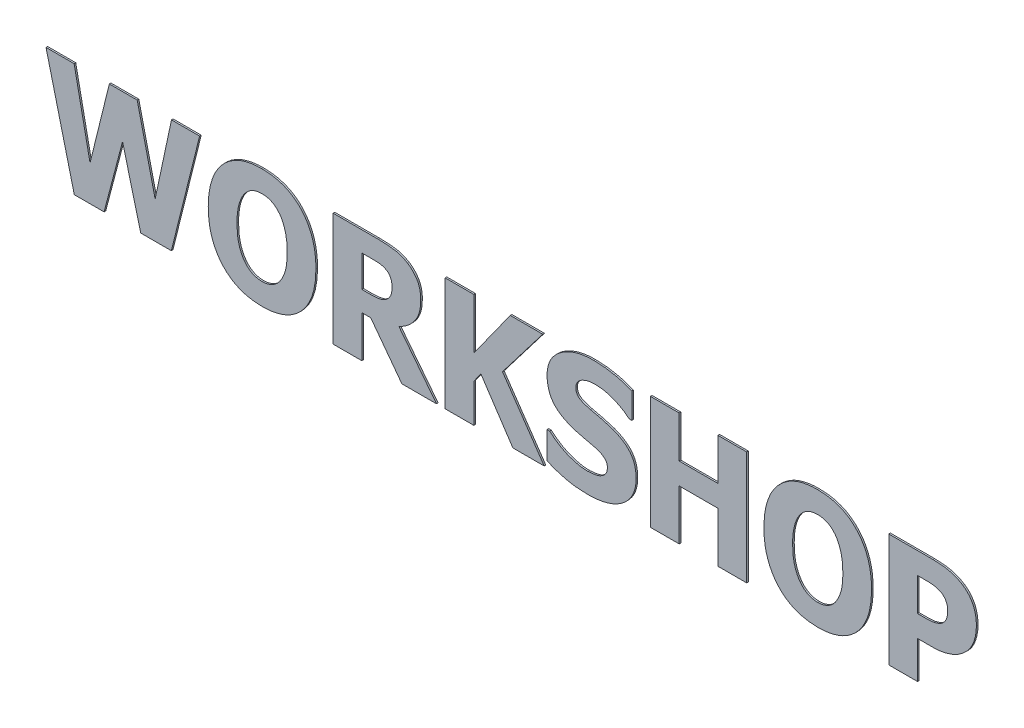
from build123d import *

# Parameters (mm, degrees)
BOSS_EXTRUDE1_DEPTH   = 2
BOSS_EXTRUDE1_2_DEPTH = 2
BOSS_EXTRUDE1_3_DEPTH = 2
BOSS_EXTRUDE1_4_DEPTH = 2
BOSS_EXTRUDE1_5_DEPTH = 2
BOSS_EXTRUDE1_6_DEPTH = 2
BOSS_EXTRUDE1_7_DEPTH = 2
BOSS_EXTRUDE1_8_DEPTH = 2


with BuildPart() as part:
    # Sketch1 → Boss-Extrude1 (new body)
    with BuildSketch(Plane.XY):
        Polygon((193.164556962, 140), (158.219936709, 0), (120.478639241, 0), (98.022151899, 86.586234177), (75.233386076, 0), (38.488924051, 0), (3.544303797, 140), (38.267405063, 140), (57.899525316, 43.556170886), (81.712816456, 140), (116.103639241, 140), (138.255537975, 45.300632911), (158.441455696, 140), align=None)
    extrude(amount=BOSS_EXTRUDE1_DEPTH)


with BuildPart() as body_2:
    # Sketch1 → Boss-Extrude1 2 (new body)
    with BuildSketch(Plane.XY):
        with BuildLine():
            add(Edge.make_bspline(
                [(336.708860759, 69.944620253), (336.658790443, 67.164216989), (336.561241052, 61.747301978), (335.714073569, 53.849942234), (334.346306395, 46.410543901), (332.418303155, 39.411771393), (329.87864808, 32.885364694), (326.846877088, 26.773474043), (323.190648714, 21.163056986), (319.034989894, 16.0200979), (314.38439322, 11.419140562), (309.28992765, 7.412439715), (303.789331489, 3.998747634), (297.868446677, 1.225043183), (291.518023102, -0.906382177), (284.778130489, -2.454279453), (277.616661888, -3.378879746), (272.71109732, -3.488262656), (270.19778481, -3.544303797)],
                knots=[0, 0, 0, 0, 1.189079844, 2.316622391, 3.39301205, 4.421840737, 5.416816174, 6.384428204, 7.335006513, 8.275362366, 9.207852477, 10.127253029, 11.042132357, 11.971180715, 12.917592702, 13.902165424, 14.925197332, 16, 16, 16, 16], degree=3))
            add(Edge.make_bspline(
                [(270.19778481, -3.544303797), (267.674728102, -3.492134328), (262.757733395, -3.39046519), (255.592789719, -2.415395693), (248.844314399, -0.887810447), (242.498406324, 1.283021893), (236.577643455, 4.082587086), (231.069958075, 7.523801264), (225.982038692, 11.57882398), (221.363335336, 16.254943386), (217.201086643, 21.418602463), (213.624300738, 27.09251463), (210.559609016, 33.167634607), (208.104540149, 39.701956061), (206.158206098, 46.648831226), (204.795418927, 54.034924349), (203.945336508, 61.848478572), (203.847576748, 67.201063638), (203.797468354, 69.944620253)],
                knots=[0, 0, 0, 0, 1.080317887, 2.105349957, 3.091355781, 4.040422853, 4.97251073, 5.890809664, 6.816459549, 7.753090285, 8.700970549, 9.651987685, 10.62100813, 11.610906846, 12.637424941, 13.707608467, 14.824996543, 16, 16, 16, 16], degree=3))
            add(Edge.make_bspline(
                [(203.797468354, 69.944620253), (203.848166743, 72.706556899), (203.947260988, 78.104993251), (204.790682778, 85.974665241), (206.158498804, 93.406264689), (208.105031387, 100.380525267), (210.554678422, 106.935452331), (213.61623598, 113.014404695), (217.211208292, 118.666904735), (221.354223001, 123.827244812), (225.983090434, 128.478044386), (231.078289555, 132.502108582), (236.576573893, 135.946994953), (242.499207831, 138.741927513), (248.840179118, 140.924183705), (255.597129139, 142.405673499), (262.757112353, 143.393166655), (267.674517496, 143.493050444), (270.19778481, 143.544303797)],
                knots=[0, 0, 0, 0, 1.181311189, 2.308971597, 3.381592327, 4.410528555, 5.402783556, 6.37049673, 7.316900563, 8.263502075, 9.196072939, 10.118016634, 11.035076724, 11.965907153, 12.913693872, 13.897490296, 14.921139532, 16, 16, 16, 16], degree=3))
            add(Edge.make_bspline(
                [(270.19778481, 143.544303797), (272.711180313, 143.488504535), (277.61690687, 143.379593733), (284.77721979, 142.451625272), (291.524159378, 140.91511485), (297.86261268, 138.739515885), (303.790386972, 135.976174685), (309.288767126, 132.558226824), (314.39315091, 128.553169146), (319.035422745, 123.922953877), (323.182966166, 118.757164536), (326.847908715, 113.144205593), (329.878349778, 107.031356168), (332.418431378, 100.505222251), (334.346094603, 93.506351056), (335.716497883, 86.058032146), (336.559787417, 78.1509912), (336.658353962, 72.724979964), (336.708860759, 69.944620253)],
                knots=[0, 0, 0, 0, 1.074060791, 2.096386557, 3.080279682, 4.027313204, 4.955720291, 5.869968128, 6.788734069, 7.723357901, 8.666132665, 9.616054842, 10.582998983, 11.577287643, 12.605406185, 13.681052873, 14.811740912, 16, 16, 16, 16], degree=3))
        make_face()
        with BuildLine():
            add(Edge.make_bspline(
                [(301.265822785, 70.055379747), (301.234078064, 72.086892796), (301.173093752, 75.989602382), (300.706765167, 81.615210054), (299.918540635, 86.762225484), (298.812100112, 91.456729694), (297.413411974, 95.703462917), (295.843098804, 99.57138613), (294.072545361, 103.065274153), (292.631457572, 105.134367011), (291.934335443, 106.13528481)],
                knots=[0, 0, 0, 0, 1.287174704, 2.472772232, 3.57375833, 4.583793058, 5.525202796, 6.403859325, 7.227871477, 8, 8, 8, 8], degree=3))
            add(Edge.make_bspline(
                [(291.934335443, 106.13528481), (291.185333192, 107.04538827), (289.730874706, 108.812682959), (287.315908656, 111.15755358), (284.687029916, 113.006500824), (281.953640386, 114.493687636), (279.119228678, 115.597834925), (276.228995295, 116.367315405), (273.288335222, 116.863891095), (271.30734599, 116.929131523), (270.308544304, 116.962025316)],
                knots=[0, 0, 0, 0, 1.126585517, 2.187672819, 3.206336016, 4.189521334, 5.156373335, 6.106816172, 7.045469219, 8, 8, 8, 8], degree=3))
            add(Edge.make_bspline(
                [(270.308544304, 116.962025316), (269.263687818, 116.939701999), (267.219431715, 116.896026549), (264.234533868, 116.427818184), (261.395044927, 115.725747614), (258.689154451, 114.67660383), (256.060397753, 113.291156382), (253.566620463, 111.368400839), (251.048598698, 109.08901875), (249.54661631, 107.273103128), (248.765822785, 106.329113924)],
                knots=[0, 0, 0, 0, 1.002961705, 1.962289189, 2.895653215, 3.80792997, 4.744195718, 5.739089679, 6.824683862, 8, 8, 8, 8], degree=3))
            add(Edge.make_bspline(
                [(248.765822785, 106.329113924), (248.069224443, 105.34653577), (246.621983926, 103.305148606), (244.82398224, 99.83043703), (243.178183607, 95.938076208), (241.792502347, 91.588609853), (240.5976068, 86.806968004), (239.843833001, 81.565637252), (239.322843319, 75.899246919), (239.268602615, 71.976548941), (239.240506329, 69.944620253)],
                knots=[0, 0, 0, 0, 0.755164283, 1.568916089, 2.449019537, 3.40530965, 4.430988336, 5.538686369, 6.72505765, 8, 8, 8, 8], degree=3))
            add(Edge.make_bspline(
                [(239.240506329, 69.944620253), (239.271394048, 67.866876711), (239.330510474, 63.890254994), (239.801353114, 58.202234288), (240.55276183, 53.061627121), (241.638901071, 48.442114623), (243.00192908, 44.276015955), (244.621058508, 40.496365647), (246.419178491, 37.033710072), (247.866837134, 34.958582389), (248.571993671, 33.94778481)],
                knots=[0, 0, 0, 0, 1.318170318, 2.522864159, 3.618647017, 4.611587825, 5.530173897, 6.396057923, 7.218717585, 8, 8, 8, 8], degree=3))
            add(Edge.make_bspline(
                [(248.571993671, 33.94778481), (249.319259904, 33.026697979), (250.774400831, 31.233078671), (253.218028413, 28.882990385), (255.842302885, 26.98169056), (258.610405081, 25.507977487), (261.462376996, 24.40678244), (264.36889951, 23.628524531), (267.319946556, 23.138379123), (269.309846042, 23.071526787), (270.308544304, 23.037974684)],
                knots=[0, 0, 0, 0, 1.126399206, 2.193421182, 3.21099292, 4.195910863, 5.165042014, 6.109693258, 7.051285721, 8, 8, 8, 8], degree=3))
            add(Edge.make_bspline(
                [(270.308544304, 23.037974684), (271.316371715, 23.070891082), (273.335024335, 23.136821788), (276.341356983, 23.642973019), (279.281054189, 24.52549535), (282.183321903, 25.667770161), (284.945854509, 27.22607241), (287.546590187, 29.144518338), (289.918406495, 31.474838386), (291.30722102, 33.239325823), (292.017405063, 34.141613924)],
                knots=[0, 0, 0, 0, 0.954659109, 1.912157864, 2.877967119, 3.858822935, 4.861119912, 5.873816251, 6.912754912, 8, 8, 8, 8], degree=3))
            add(Edge.make_bspline(
                [(292.017405063, 34.141613924), (292.728746266, 35.200555032), (294.174972846, 37.353486385), (296.01153544, 40.843696463), (297.597707167, 44.587174249), (298.952733822, 48.634224614), (300.018833083, 53.143604601), (300.725157028, 58.222906973), (301.215465123, 63.926375922), (301.248446421, 67.940511925), (301.265822785, 70.055379747)],
                knots=[0, 0, 0, 0, 0.811098523, 1.649043018, 2.504094341, 3.39537459, 4.360999606, 5.44717599, 6.655031781, 8, 8, 8, 8], degree=3))
        make_face(mode=Mode.SUBTRACT)
    extrude(amount=BOSS_EXTRUDE1_2_DEPTH)


with BuildPart() as body_3:
    # Sketch1 → Boss-Extrude1 3 (new body)
    with BuildSketch(Plane.XY):
        with BuildLine():
            Line((485.569620253, 0), (442.84414557, 0))
            Line((442.84414557, 0), (404.382911392, 51.392405063))
            Line((404.382911392, 51.392405063), (393.417721519, 51.392405063))
            Line((393.417721519, 51.392405063), (393.417721519, 0))
            Line((393.417721519, 0), (357.974683544, 0))
            Line((357.974683544, 0), (357.974683544, 140))
            Line((357.974683544, 140), (413.852848101, 140))
            add(Edge.make_bspline(
                [(413.852848101, 140), (415.717633835, 139.987060547), (419.320224568, 139.962062739), (424.540344665, 139.686243322), (429.389195696, 139.211487907), (433.917463522, 138.596545647), (438.197976362, 137.704332633), (442.258376503, 136.343702791), (446.182897464, 134.655684296), (448.627361424, 133.197500233), (449.849683544, 132.46835443)],
                knots=[0, 0, 0, 0, 1.199793894, 2.317889013, 3.362092139, 4.333845176, 5.257590495, 6.170331022, 7.085098041, 8, 8, 8, 8], degree=3))
            add(Edge.make_bspline(
                [(449.849683544, 132.46835443), (451.054490233, 131.649281641), (453.43308472, 130.032223866), (456.574467779, 127.094487243), (459.366758765, 123.874569706), (461.770132403, 120.299215148), (463.769495252, 116.325204082), (465.089429754, 111.815193185), (465.936219158, 106.841069751), (466.028175088, 103.351643287), (466.075949367, 101.538765823)],
                knots=[0, 0, 0, 0, 0.953924463, 1.883289238, 2.810108911, 3.743307755, 4.701369409, 5.714009315, 6.812348952, 8, 8, 8, 8], degree=3))
            add(Edge.make_bspline(
                [(466.075949367, 101.538765823), (466.059237539, 100.227036461), (466.026570541, 97.662968549), (465.638948759, 93.920702229), (465.111129662, 90.361571462), (464.303495303, 86.989622787), (463.249879837, 83.819304221), (462.003307686, 80.817773683), (460.506922807, 78.019141497), (458.200809156, 74.550819213), (454.865551051, 70.552438315), (450.217242035, 66.304107475), (444.987793467, 62.502350438), (441.110612129, 60.499213803), (439.133702532, 59.477848101)],
                knots=[0, 0, 0, 0, 0.888936574, 1.737625011, 2.548320823, 3.326937543, 4.084834997, 4.811205944, 5.527889522, 6.232533624, 7.632244915, 9.044932759, 10.493260882, 12, 12, 12, 12], degree=3))
            Line((439.133702532, 59.477848101), (485.569620253, 0))
        make_face()
        with BuildLine():
            add(Edge.make_bspline(
                [(430.632911392, 97.496044304), (430.61918029, 98.374915222), (430.592581296, 100.07740657), (430.172350062, 102.531332311), (429.600114691, 104.817643531), (428.686252954, 106.88479496), (427.560946235, 108.796424219), (426.03527056, 110.429592353), (424.192331729, 111.854397105), (422.782870152, 112.572908961), (422.049050633, 112.946993671)],
                knots=[0, 0, 0, 0, 1.119761289, 2.169128442, 3.168954851, 4.118408773, 5.043447249, 5.985348535, 6.951095516, 8, 8, 8, 8], degree=3))
            add(Edge.make_bspline(
                [(422.049050633, 112.946993671), (420.916212447, 113.383893801), (418.582845326, 114.283800257), (415.400911739, 114.784611202), (412.645124844, 114.973307579), (410.301429451, 115.13383544), (407.714945512, 115.163974649), (405.90580812, 115.181009237), (404.964398734, 115.189873418)],
                knots=[0, 0, 0, 0, 1.256441546, 2.587959541, 3.317795867, 4.123378269, 5.023474215, 6, 6, 6, 6], degree=3))
            Line((404.964398734, 115.189873418), (393.417721519, 115.189873418))
            Line((393.417721519, 115.189873418), (393.417721519, 76.202531646))
            Line((393.417721519, 76.202531646), (403.303006329, 76.202531646))
            add(Edge.make_bspline(
                [(403.303006329, 76.202531646), (404.456846525, 76.213368735), (406.673527492, 76.234188231), (409.872267316, 76.386098453), (412.788113631, 76.706954612), (415.473539711, 77.060878928), (417.92469215, 77.660178239), (420.168553149, 78.537964007), (422.252583019, 79.627335879), (423.465719269, 80.594074852), (424.070411392, 81.075949367)],
                knots=[0, 0, 0, 0, 1.270824428, 2.441423287, 3.524730841, 4.500863784, 5.422940595, 6.295084937, 7.15017896, 8, 8, 8, 8], degree=3))
            add(Edge.make_bspline(
                [(424.070411392, 81.075949367), (424.599514574, 81.534021567), (425.653693761, 82.446679429), (427.001465145, 84.024053977), (428.122302096, 85.743271638), (429.057277328, 87.604631816), (429.78787717, 89.685190063), (430.267376658, 92.041436412), (430.571302274, 94.67298005), (430.611740941, 96.525968031), (430.632911392, 97.496044304)],
                knots=[0, 0, 0, 0, 0.914359853, 1.821760216, 2.702345359, 3.593131941, 4.539985656, 5.57704332, 6.731533712, 8, 8, 8, 8], degree=3))
        make_face(mode=Mode.SUBTRACT)
    extrude(amount=BOSS_EXTRUDE1_3_DEPTH)


with BuildPart() as body_4:
    # Sketch1 → Boss-Extrude1 4 (new body)
    with BuildSketch(Plane.XY):
        Polygon((618.481012658, 0), (579.798259494, 0), (540.340189873, 59.339398734), (531.64556962, 47.238924051), (531.64556962, 0), (496.202531646, 0), (496.202531646, 140), (531.64556962, 140), (531.64556962, 77.310126582), (576.558544304, 140), (616.708860759, 140), (567.005537975, 75.039556962), align=None)
    extrude(amount=BOSS_EXTRUDE1_4_DEPTH)


with BuildPart() as body_5:
    # Sketch1 → Boss-Extrude1 5 (new body)
    with BuildSketch(Plane.XY):
        with BuildLine():
            add(Edge.make_bspline(
                [(672.088607595, -3.544303797), (669.530664289, -3.510003211), (664.573914765, -3.443535978), (657.371197847, -2.84912766), (650.641624835, -1.909041645), (644.352465668, -0.52448944), (638.43508191, 1.15981472), (632.76516752, 3.037058912), (627.285385348, 5.018077661), (623.76232562, 6.553233457), (622.025316456, 7.310126582)],
                knots=[0, 0, 0, 0, 1.188587951, 2.303230391, 3.356350567, 4.344124042, 5.293358606, 6.214416522, 7.119636025, 8, 8, 8, 8], degree=3))
            Line((622.025316456, 7.310126582), (622.025316456, 40.759493671))
            Line((622.025316456, 40.759493671), (625.181962025, 40.759493671))
            add(Edge.make_bspline(
                [(625.181962025, 40.759493671), (626.927777511, 39.249418597), (630.384642955, 36.259339529), (636.002582133, 32.38351496), (641.848448741, 29.012606631), (647.927865908, 26.236732244), (654.074066036, 24.014333902), (660.210182493, 22.480446613), (666.237701352, 21.430777729), (670.24760817, 21.320339478), (672.227056962, 21.265822785)],
                knots=[0, 0, 0, 0, 1.064005933, 2.106823643, 3.142324773, 4.172904671, 5.185521809, 6.151983196, 7.087745727, 8, 8, 8, 8], degree=3))
            add(Edge.make_bspline(
                [(672.227056962, 21.265822785), (672.762619884, 21.279658753), (673.908999767, 21.309274836), (675.746454146, 21.459021893), (677.814186659, 21.683089721), (680.052886905, 21.969513749), (682.29171746, 22.365535987), (684.377328444, 22.854664208), (686.223012459, 23.445308539), (687.322957963, 23.976801652), (687.84414557, 24.228639241)],
                knots=[0, 0, 0, 0, 0.803171281, 1.719199296, 2.763054104, 3.921781135, 5.102693432, 6.170135007, 7.132954358, 8, 8, 8, 8], degree=3))
            add(Edge.make_bspline(
                [(687.84414557, 24.228639241), (688.432913527, 24.539136505), (689.601943014, 25.155645018), (691.215304224, 26.29529486), (692.659273367, 27.626861307), (694.018897468, 29.06865939), (695.107950932, 30.79253638), (695.933379959, 32.749676851), (696.353378878, 34.982656055), (696.420581857, 36.539940057), (696.455696203, 37.353639241)],
                knots=[0, 0, 0, 0, 0.958250464, 1.902656275, 2.834625234, 3.785374419, 4.748042504, 5.755488648, 6.827216455, 8, 8, 8, 8], degree=3))
            add(Edge.make_bspline(
                [(696.455696203, 37.353639241), (696.413077555, 38.208980577), (696.330073335, 39.87484619), (695.524744978, 42.239746748), (694.168589302, 44.314082787), (692.347191785, 46.10469587), (690.174760355, 47.598977347), (687.848009528, 49.008384766), (685.253131039, 50.056697083), (683.44557123, 50.612002492), (682.527689873, 50.893987342)],
                knots=[0, 0, 0, 0, 0.976980105, 1.90276968, 2.820378867, 3.79191295, 4.806747273, 5.83454199, 6.900377446, 8, 8, 8, 8], degree=3))
            add(Edge.make_bspline(
                [(682.527689873, 50.893987342), (680.076213081, 51.528331495), (675.031713573, 52.833646227), (667.321631263, 54.503759796), (659.617231601, 56.282041763), (654.65233978, 57.909926061), (652.234968354, 58.702531646)],
                knots=[0, 0, 0, 0, 0.970778871, 1.997609583, 3.025049981, 4, 4, 4, 4], degree=3))
            add(Edge.make_bspline(
                [(652.234968354, 58.702531646), (650.927463692, 59.195271424), (648.38662316, 60.152800093), (644.764182995, 61.803473174), (641.424953328, 63.552380015), (638.375302975, 65.456532439), (635.609365103, 67.464115634), (633.119334221, 69.606586943), (630.932284442, 71.885028367), (628.984749842, 74.276004392), (627.367460625, 76.858107155), (625.905216072, 79.534412097), (624.719797376, 82.400452024), (623.713226837, 85.402270258), (622.985275574, 88.578368143), (622.421570585, 91.886290602), (622.086249128, 95.357018822), (622.04591477, 97.726069515), (622.025316456, 98.935917722)],
                knots=[0, 0, 0, 0, 1.232734205, 2.395541005, 3.510463934, 4.556875624, 5.565319495, 6.523880384, 7.451310254, 8.349375782, 9.239576409, 10.136015274, 11.0376197, 11.972601359, 12.926826808, 13.909683999, 14.932498543, 16, 16, 16, 16], degree=3))
            add(Edge.make_bspline(
                [(622.025316456, 98.935917722), (622.069373647, 100.554344067), (622.156004572, 103.736702478), (622.95458943, 108.395691259), (624.257704342, 112.818819076), (626.064282094, 117.013236705), (628.421838352, 120.950394488), (631.291798777, 124.643432631), (634.67823051, 128.101876946), (638.545697898, 131.278722914), (642.778811307, 134.182531459), (647.345239342, 136.656507114), (652.129742564, 138.814595381), (657.179587114, 140.560062917), (662.503453259, 141.877480686), (668.063680925, 142.842557889), (673.884690474, 143.439227315), (677.846659695, 143.508788832), (679.869462025, 143.544303797)],
                knots=[0, 0, 0, 0, 0.951733787, 1.8714216, 2.771937187, 3.659834458, 4.551246461, 5.464900409, 6.405895824, 7.393377429, 8.405714223, 9.421759516, 10.445282372, 11.49132611, 12.560961497, 13.669079994, 14.809937645, 16, 16, 16, 16], degree=3))
            add(Edge.make_bspline(
                [(679.869462025, 143.544303797), (681.93786691, 143.51035324), (686.0798811, 143.442366699), (692.271208014, 142.954128455), (698.447345606, 142.189037409), (704.54021813, 141.072461567), (710.484027313, 139.735698603), (716.158883544, 138.159141603), (721.521983043, 136.382168305), (724.919608759, 134.962787546), (726.582278481, 134.268196203)],
                knots=[0, 0, 0, 0, 1.035526462, 2.073658467, 3.107699001, 4.15013179, 5.173679131, 6.156969703, 7.09809057, 8, 8, 8, 8], degree=3))
            Line((726.582278481, 134.268196203), (726.582278481, 102.784810127))
            Line((726.582278481, 102.784810127), (723.481012658, 102.784810127))
            add(Edge.make_bspline(
                [(723.481012658, 102.784810127), (722.13411137, 103.88139387), (719.384609511, 106.119909094), (714.807060328, 109.052395374), (709.838809261, 111.783833147), (704.497109344, 114.179752954), (698.91691474, 116.23061095), (693.167711924, 117.643761393), (687.349490952, 118.591889793), (683.435943824, 118.686688395), (681.475474684, 118.734177215)],
                knots=[0, 0, 0, 0, 0.909132475, 1.855860894, 2.842486714, 3.876811078, 4.919788485, 5.951669293, 6.973900401, 8, 8, 8, 8], degree=3))
            add(Edge.make_bspline(
                [(681.475474684, 118.734177215), (680.024528516, 118.709270216), (677.258419852, 118.661787085), (673.22664419, 118.104248359), (669.314377539, 117.015956355), (666.831464064, 115.873547995), (665.526107595, 115.272943038)],
                knots=[0, 0, 0, 0, 1.055808145, 2.01281076, 2.955263502, 4, 4, 4, 4], degree=3))
            add(Edge.make_bspline(
                [(665.526107595, 115.272943038), (664.991663591, 114.98162979), (663.918419713, 114.396629009), (662.436463099, 113.260298991), (661.063729249, 111.939691321), (659.816031879, 110.445539147), (658.750920282, 108.818840907), (658.043069465, 107.02446453), (657.529187832, 105.167148318), (657.488734382, 103.87753795), (657.46835443, 103.227848101)],
                knots=[0, 0, 0, 0, 0.957416142, 1.922635494, 2.930164298, 3.951958416, 4.984347753, 5.975062963, 6.979861616, 8, 8, 8, 8], degree=3))
            add(Edge.make_bspline(
                [(657.46835443, 103.227848101), (657.51710634, 102.364906821), (657.611087576, 100.701376358), (658.311832889, 98.330032984), (659.542522598, 96.263579292), (660.945493308, 94.781443795), (662.35510944, 93.7637183), (663.629716045, 92.989548706), (665.138714119, 92.238072217), (666.874497965, 91.548858521), (668.801480724, 90.803582064), (670.959636463, 90.125903725), (673.345585214, 89.465338676), (675.013541468, 89.046974633), (675.882120253, 88.829113924)],
                knots=[0, 0, 0, 0, 1.214264784, 2.34079248, 3.441844924, 4.572488008, 5.185916398, 5.885766898, 6.670379076, 7.556104553, 8.514370256, 9.57884454, 10.739196989, 12, 12, 12, 12], degree=3))
            add(Edge.make_bspline(
                [(675.882120253, 88.829113924), (678.181266599, 88.306521762), (682.691912955, 87.281259305), (689.451244457, 85.680411257), (696.341907825, 83.913241735), (700.915272692, 82.32024062), (703.295094937, 81.491297468)],
                knots=[0, 0, 0, 0, 0.996266869, 1.954554799, 2.935620461, 4, 4, 4, 4], degree=3))
            add(Edge.make_bspline(
                [(703.295094937, 81.491297468), (704.474297289, 81.046352578), (706.778274512, 80.176999755), (710.03911098, 78.624283692), (713.10591321, 77.044038694), (715.906541499, 75.283389602), (718.490501985, 73.429009171), (720.853152853, 71.469648174), (722.965240215, 69.377502881), (724.875799894, 67.180033671), (726.539477868, 64.811716098), (727.993121456, 62.288243079), (729.178302571, 59.568159235), (730.183546377, 56.683405135), (730.950183467, 53.605229124), (731.501909964, 50.347199632), (731.838234419, 46.913730771), (731.878280206, 44.563007891), (731.898734177, 43.362341772)],
                knots=[0, 0, 0, 0, 1.17454689, 2.294881178, 3.365011102, 4.38938974, 5.375760562, 6.328835541, 7.247690706, 8.144686596, 9.040029798, 9.941965584, 10.855040075, 11.802113214, 12.787244475, 13.808691087, 14.880756899, 16, 16, 16, 16], degree=3))
            add(Edge.make_bspline(
                [(731.898734177, 43.362341772), (731.852366523, 41.64287478), (731.761416556, 38.270147264), (731.001450938, 33.335006508), (729.728751698, 28.661686462), (727.942485639, 24.246631731), (725.652469956, 20.094914664), (722.871680355, 16.186655056), (719.536993745, 12.578509423), (715.750161954, 9.240882374), (711.547396103, 6.219880836), (706.944544112, 3.612934907), (701.998857437, 1.402227723), (696.704504713, -0.440671924), (691.04823716, -1.839138648), (685.038047321, -2.819316732), (678.682971469, -3.44842657), (674.323803084, -3.51180569), (672.088607595, -3.544303797)],
                knots=[0, 0, 0, 0, 0.965575501, 1.893972421, 2.797150248, 3.681070906, 4.56293602, 5.455031491, 6.368877871, 7.316649527, 8.286503653, 9.271159268, 10.283057314, 11.32599161, 12.416327018, 13.55177918, 14.744656859, 16, 16, 16, 16], degree=3))
        make_face()
    extrude(amount=BOSS_EXTRUDE1_5_DEPTH)


with BuildPart() as body_6:
    # Sketch1 → Boss-Extrude1 6 (new body)
    with BuildSketch(Plane.XY):
        Polygon((868.35443038, 0), (832.911392405, 0), (832.911392405, 62.025316456), (785.063291139, 62.025316456), (785.063291139, 0), (749.620253165, 0), (749.620253165, 140), (785.063291139, 140), (785.063291139, 88.607594937), (832.911392405, 88.607594937), (832.911392405, 140), (868.35443038, 140), align=None)
    extrude(amount=BOSS_EXTRUDE1_6_DEPTH)


with BuildPart() as body_7:
    # Sketch1 → Boss-Extrude1 7 (new body)
    with BuildSketch(Plane.XY):
        with BuildLine():
            add(Edge.make_bspline(
                [(1022.53164557, 69.944620253), (1022.481575253, 67.164216989), (1022.384025862, 61.747301978), (1021.536858379, 53.849942234), (1020.169091205, 46.410543901), (1018.241087965, 39.411771393), (1015.70143289, 32.885364694), (1012.669661899, 26.773474043), (1009.013433524, 21.163056986), (1004.857774704, 16.0200979), (1000.20717803, 11.419140562), (995.11271246, 7.412439715), (989.612116299, 3.998747634), (983.691231487, 1.225043183), (977.340807912, -0.906382177), (970.600915299, -2.454279453), (963.439446698, -3.378879746), (958.53388213, -3.488262656), (956.02056962, -3.544303797)],
                knots=[0, 0, 0, 0, 1.189079844, 2.316622391, 3.39301205, 4.421840737, 5.416816174, 6.384428204, 7.335006513, 8.275362366, 9.207852477, 10.127253029, 11.042132357, 11.971180715, 12.917592702, 13.902165424, 14.925197332, 16, 16, 16, 16], degree=3))
            add(Edge.make_bspline(
                [(956.02056962, -3.544303797), (953.497512913, -3.492134328), (948.580518205, -3.39046519), (941.415574529, -2.415395693), (934.667099209, -0.887810447), (928.321191134, 1.283021893), (922.400428266, 4.082587086), (916.892742885, 7.523801264), (911.804823502, 11.57882398), (907.186120146, 16.254943386), (903.023871453, 21.418602463), (899.447085548, 27.09251463), (896.382393826, 33.167634607), (893.92732496, 39.701956061), (891.980990908, 46.648831226), (890.618203737, 54.034924349), (889.768121318, 61.848478572), (889.670361558, 67.201063638), (889.620253165, 69.944620253)],
                knots=[0, 0, 0, 0, 1.080317887, 2.105349957, 3.091355781, 4.040422853, 4.97251073, 5.890809664, 6.816459549, 7.753090285, 8.700970549, 9.651987685, 10.62100813, 11.610906846, 12.637424941, 13.707608467, 14.824996543, 16, 16, 16, 16], degree=3))
            add(Edge.make_bspline(
                [(889.620253165, 69.944620253), (889.670951553, 72.706556899), (889.770045798, 78.104993251), (890.613467588, 85.974665241), (891.981283614, 93.406264689), (893.927816197, 100.380525267), (896.377463232, 106.935452331), (899.43902079, 113.014404695), (903.033993102, 118.666904735), (907.177007811, 123.827244812), (911.805875244, 128.478044386), (916.901074365, 132.502108582), (922.399358703, 135.946994953), (928.321992641, 138.741927513), (934.662963928, 140.924183705), (941.419913949, 142.405673499), (948.579897163, 143.393166655), (953.497302306, 143.493050444), (956.02056962, 143.544303797)],
                knots=[0, 0, 0, 0, 1.181311189, 2.308971597, 3.381592327, 4.410528555, 5.402783556, 6.37049673, 7.316900563, 8.263502075, 9.196072939, 10.118016634, 11.035076724, 11.965907153, 12.913693872, 13.897490296, 14.921139532, 16, 16, 16, 16], degree=3))
            add(Edge.make_bspline(
                [(956.02056962, 143.544303797), (958.533965123, 143.488504535), (963.439691681, 143.379593733), (970.6000046, 142.451625272), (977.346944188, 140.91511485), (983.68539749, 138.739515885), (989.613171783, 135.976174685), (995.111551936, 132.558226824), (1000.21593572, 128.553169146), (1004.858207555, 123.922953877), (1009.005750976, 118.757164536), (1012.670693525, 113.144205593), (1015.701134588, 107.031356168), (1018.241216188, 100.505222251), (1020.168879413, 93.506351056), (1021.539282693, 86.058032146), (1022.382572227, 78.1509912), (1022.481138772, 72.724979964), (1022.53164557, 69.944620253)],
                knots=[0, 0, 0, 0, 1.074060791, 2.096386557, 3.080279682, 4.027313204, 4.955720291, 5.869968128, 6.788734069, 7.723357901, 8.666132665, 9.616054842, 10.582998983, 11.577287643, 12.605406185, 13.681052873, 14.811740912, 16, 16, 16, 16], degree=3))
        make_face()
        with BuildLine():
            add(Edge.make_bspline(
                [(987.088607595, 70.055379747), (987.056862874, 72.086892796), (986.995878562, 75.989602382), (986.529549977, 81.615210054), (985.741325445, 86.762225484), (984.634884922, 91.456729694), (983.236196784, 95.703462917), (981.665883614, 99.57138613), (979.895330171, 103.065274153), (978.454242382, 105.134367011), (977.757120253, 106.13528481)],
                knots=[0, 0, 0, 0, 1.287174704, 2.472772232, 3.57375833, 4.583793058, 5.525202796, 6.403859325, 7.227871477, 8, 8, 8, 8], degree=3))
            add(Edge.make_bspline(
                [(977.757120253, 106.13528481), (977.008118002, 107.04538827), (975.553659516, 108.812682959), (973.138693467, 111.15755358), (970.509814726, 113.006500824), (967.776425196, 114.493687636), (964.942013488, 115.597834925), (962.051780105, 116.367315405), (959.111120032, 116.863891095), (957.1301308, 116.929131523), (956.131329114, 116.962025316)],
                knots=[0, 0, 0, 0, 1.126585517, 2.187672819, 3.206336016, 4.189521334, 5.156373335, 6.106816172, 7.045469219, 8, 8, 8, 8], degree=3))
            add(Edge.make_bspline(
                [(956.131329114, 116.962025316), (955.086472628, 116.939701999), (953.042216526, 116.896026549), (950.057318678, 116.427818184), (947.217829737, 115.725747614), (944.511939262, 114.67660383), (941.883182564, 113.291156382), (939.389405274, 111.368400839), (936.871383508, 109.08901875), (935.36940112, 107.273103128), (934.588607595, 106.329113924)],
                knots=[0, 0, 0, 0, 1.002961705, 1.962289189, 2.895653215, 3.80792997, 4.744195718, 5.739089679, 6.824683862, 8, 8, 8, 8], degree=3))
            add(Edge.make_bspline(
                [(934.588607595, 106.329113924), (933.892009253, 105.34653577), (932.444768736, 103.305148606), (930.64676705, 99.83043703), (929.000968417, 95.938076208), (927.615287157, 91.588609853), (926.42039161, 86.806968004), (925.666617811, 81.565637252), (925.145628129, 75.899246919), (925.091387425, 71.976548941), (925.063291139, 69.944620253)],
                knots=[0, 0, 0, 0, 0.755164283, 1.568916089, 2.449019537, 3.40530965, 4.430988336, 5.538686369, 6.72505765, 8, 8, 8, 8], degree=3))
            add(Edge.make_bspline(
                [(925.063291139, 69.944620253), (925.094178858, 67.866876711), (925.153295284, 63.890254994), (925.624137925, 58.202234288), (926.37554664, 53.061627121), (927.461685881, 48.442114623), (928.82471389, 44.276015955), (930.443843318, 40.496365647), (932.241963301, 37.033710072), (933.689621944, 34.958582389), (934.394778481, 33.94778481)],
                knots=[0, 0, 0, 0, 1.318170318, 2.522864159, 3.618647017, 4.611587825, 5.530173897, 6.396057923, 7.218717585, 8, 8, 8, 8], degree=3))
            add(Edge.make_bspline(
                [(934.394778481, 33.94778481), (935.142044714, 33.026697979), (936.597185641, 31.233078671), (939.040813223, 28.882990385), (941.665087695, 26.98169056), (944.433189892, 25.507977487), (947.285161806, 24.40678244), (950.19168432, 23.628524531), (953.142731366, 23.138379123), (955.132630852, 23.071526787), (956.131329114, 23.037974684)],
                knots=[0, 0, 0, 0, 1.126399206, 2.193421182, 3.21099292, 4.195910863, 5.165042014, 6.109693258, 7.051285721, 8, 8, 8, 8], degree=3))
            add(Edge.make_bspline(
                [(956.131329114, 23.037974684), (957.139156526, 23.070891082), (959.157809146, 23.136821788), (962.164141793, 23.642973019), (965.103838999, 24.52549535), (968.006106713, 25.667770161), (970.768639319, 27.22607241), (973.369374997, 29.144518338), (975.741191305, 31.474838386), (977.13000583, 33.239325823), (977.840189873, 34.141613924)],
                knots=[0, 0, 0, 0, 0.954659109, 1.912157864, 2.877967119, 3.858822935, 4.861119912, 5.873816251, 6.912754912, 8, 8, 8, 8], degree=3))
            add(Edge.make_bspline(
                [(977.840189873, 34.141613924), (978.551531076, 35.200555032), (979.997757656, 37.353486385), (981.83432025, 40.843696463), (983.420491977, 44.587174249), (984.775518632, 48.634224614), (985.841617893, 53.143604601), (986.547941838, 58.222906973), (987.038249934, 63.926375922), (987.071231232, 67.940511925), (987.088607595, 70.055379747)],
                knots=[0, 0, 0, 0, 0.811098523, 1.649043018, 2.504094341, 3.39537459, 4.360999606, 5.44717599, 6.655031781, 8, 8, 8, 8], degree=3))
        make_face(mode=Mode.SUBTRACT)
    extrude(amount=BOSS_EXTRUDE1_7_DEPTH)


with BuildPart() as body_8:
    # Sketch1 → Boss-Extrude1 8 (new body)
    with BuildSketch(Plane.XY):
        with BuildLine():
            add(Edge.make_bspline(
                [(1151.898734177, 95.945411392), (1151.861948047, 94.337668897), (1151.788977536, 91.148483407), (1151.191557157, 86.432442606), (1150.215765218, 81.830279007), (1148.880334024, 77.386641679), (1147.173903472, 73.167159321), (1145.097060796, 69.286902329), (1142.691094439, 65.746851324), (1140.793442952, 63.683867421), (1139.853639241, 62.662183544)],
                knots=[0, 0, 0, 0, 1.063710297, 2.110020389, 3.140321323, 4.174147137, 5.176882261, 6.147031497, 7.082325343, 8, 8, 8, 8], degree=3))
            add(Edge.make_bspline(
                [(1139.853639241, 62.662183544), (1138.628527467, 61.466390724), (1136.15121544, 59.048364876), (1132.010557097, 55.824578339), (1127.499323881, 52.914550371), (1124.211755218, 51.426017731), (1122.547468354, 50.672468354)],
                knots=[0, 0, 0, 0, 0.968764832, 1.958950049, 2.966746259, 4, 4, 4, 4], degree=3))
            add(Edge.make_bspline(
                [(1122.547468354, 50.672468354), (1120.759053888, 50.000941735), (1117.081266613, 48.619979938), (1112.228730241, 47.425193627), (1108.104709776, 46.736078595), (1104.797417036, 46.342869404), (1101.302964489, 46.128737625), (1098.909822295, 46.093849549), (1097.681962025, 46.075949367)],
                knots=[0, 0, 0, 0, 1.350376915, 2.776984378, 3.525044536, 4.307277317, 5.131507131, 6, 6, 6, 6], degree=3))
            Line((1097.681962025, 46.075949367), (1079.240506329, 46.075949367))
            Line((1079.240506329, 46.075949367), (1079.240506329, 0))
            Line((1079.240506329, 0), (1043.797468354, 0))
            Line((1043.797468354, 0), (1043.797468354, 140))
            Line((1043.797468354, 140), (1098.318829114, 140))
            add(Edge.make_bspline(
                [(1098.318829114, 140), (1100.276388634, 139.975467254), (1104.057759401, 139.928077936), (1109.521876766, 139.508927967), (1114.574593399, 138.833683227), (1119.246358421, 137.855821783), (1123.615972328, 136.614196209), (1127.728177104, 135.026417794), (1131.63958801, 133.121769018), (1134.070661288, 131.577976831), (1135.284810127, 130.806962025)],
                knots=[0, 0, 0, 0, 1.214603842, 2.346221106, 3.3984458, 4.37574822, 5.305696887, 6.214088113, 7.108063561, 8, 8, 8, 8], degree=3))
            add(Edge.make_bspline(
                [(1135.284810127, 130.806962025), (1136.560699325, 129.901535536), (1139.105618354, 128.095550263), (1142.390395451, 124.739768854), (1145.292840317, 121.006500518), (1147.66031464, 116.786674315), (1149.590486339, 112.177268615), (1150.94085241, 107.131069246), (1151.745250506, 101.675522835), (1151.846492774, 97.895775633), (1151.898734177, 95.945411392)],
                knots=[0, 0, 0, 0, 0.929697031, 1.854395874, 2.783053157, 3.737870402, 4.725635949, 5.75066038, 6.839332018, 8, 8, 8, 8], degree=3))
        make_face()
        with BuildLine():
            add(Edge.make_bspline(
                [(1116.455696203, 95.059335443), (1116.430071016, 95.985471292), (1116.379863182, 97.800063973), (1115.805185115, 100.401403488), (1114.916480643, 102.821531108), (1113.642434743, 104.984630181), (1112.115914022, 106.870165634), (1110.49171212, 108.519715813), (1108.660397021, 109.788730518), (1107.33743671, 110.38208531), (1106.681170886, 110.676424051)],
                knots=[0, 0, 0, 0, 1.134580206, 2.223001021, 3.251622356, 4.286955405, 5.286292656, 6.223296996, 7.118651216, 8, 8, 8, 8], degree=3))
            add(Edge.make_bspline(
                [(1106.681170886, 110.676424051), (1105.845668476, 111.002473037), (1104.212714725, 111.639721847), (1101.742990468, 112.368899822), (1099.32020589, 112.832685812), (1096.885501608, 113.120404371), (1094.267361355, 113.229935155), (1091.323633142, 113.353964827), (1087.962877413, 113.394769595), (1085.590696053, 113.409779136), (1084.335443038, 113.417721519)],
                knots=[0, 0, 0, 0, 0.948525831, 1.853853198, 2.719395299, 3.555067585, 4.444940828, 5.490429218, 6.672046606, 8, 8, 8, 8], degree=3))
            Line((1084.335443038, 113.417721519), (1079.240506329, 113.417721519))
            Line((1079.240506329, 113.417721519), (1079.240506329, 72.658227848))
            Line((1079.240506329, 72.658227848), (1081.732594937, 72.658227848))
            add(Edge.make_bspline(
                [(1081.732594937, 72.658227848), (1083.384793996, 72.667557237), (1086.578516648, 72.685591069), (1091.185769116, 72.710001851), (1095.35862129, 72.891028485), (1097.969541595, 73.224102254), (1099.17721519, 73.378164557)],
                knots=[0, 0, 0, 0, 1.13458111, 2.193160305, 3.164251553, 4, 4, 4, 4], degree=3))
            add(Edge.make_bspline(
                [(1099.17721519, 73.378164557), (1100.171403682, 73.586115166), (1102.250159255, 74.020920529), (1105.2392891, 75.12183878), (1108.023680747, 76.390668819), (1109.541153373, 77.596871948), (1110.225474684, 78.140822785)],
                knots=[0, 0, 0, 0, 1.00099375, 2.092984733, 3.140010064, 4, 4, 4, 4], degree=3))
            add(Edge.make_bspline(
                [(1110.225474684, 78.140822785), (1110.790809041, 78.702303031), (1111.883155726, 79.787202749), (1113.279275982, 81.53481082), (1114.372687686, 83.32333363), (1115.211978491, 85.190400641), (1115.799213564, 87.241309799), (1116.1595839, 89.56632733), (1116.418256315, 92.201516527), (1116.442747835, 94.070975378), (1116.455696203, 95.059335443)],
                knots=[0, 0, 0, 0, 1.023363339, 1.97735647, 2.866309643, 3.710536696, 4.600122688, 5.59850436, 6.730358582, 8, 8, 8, 8], degree=3))
        make_face(mode=Mode.SUBTRACT)
    extrude(amount=BOSS_EXTRUDE1_8_DEPTH)


solid = Compound([part.part, body_2.part, body_3.part, body_4.part, body_5.part, body_6.part, body_7.part, body_8.part])
